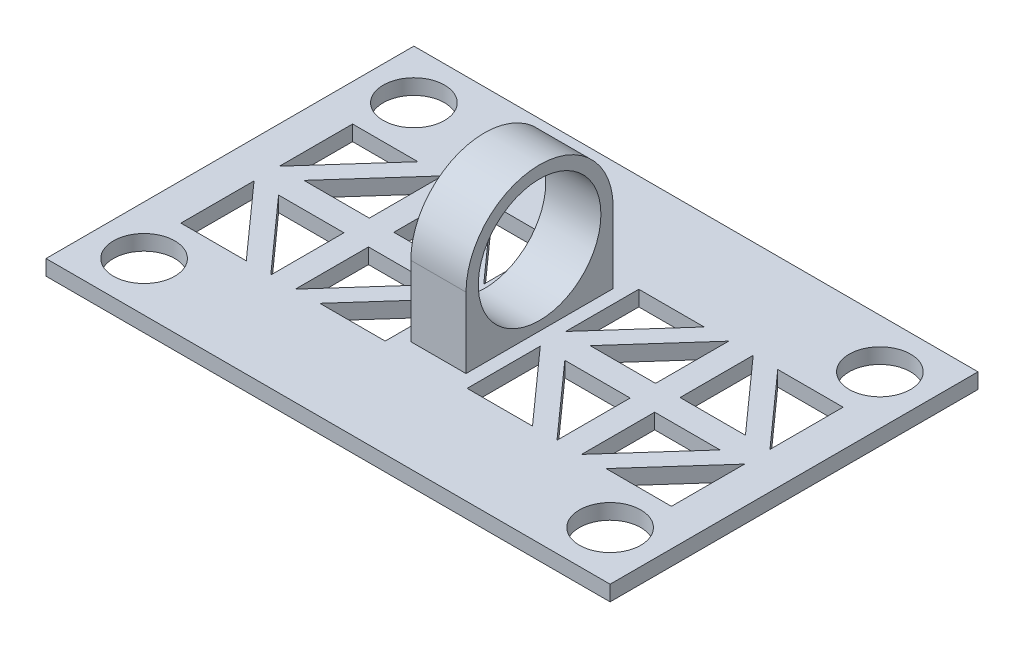
from build123d import *

# Parameters (mm, degrees)
SKETCH1_W            = 58.42
SKETCH1_H            = 38.1
BOSS_EXTRUDE1_DEPTH  = 1.5875
BOSS_EXTRUDE2_DEPTH  = 2.8575
SKETCH4_R            = 6.35
CUT_EXTRUDE1_DEPTH   = 53.464413236
CUT_EXTRUDE2_DEPTH   = 72.324521774
MIRROR4_COPY_1_DEPTH = 72.324521774
SKETCH6_R            = 3.175
CUT_EXTRUDE3_DEPTH   = 72.324521774


with BuildPart() as part:
    # Sketch1 → Boss-Extrude1 (new body)
    with BuildSketch(Plane(origin=(0, 0, 0), x_dir=(1, 0, 0), z_dir=(0, 1, 0))):
        with Locations((-29.21, 19.05)):
            Rectangle(SKETCH1_W, SKETCH1_H)
    extrude(amount=BOSS_EXTRUDE1_DEPTH)

    # Sketch2 → Boss-Extrude2 (add, symmetric)
    with BuildSketch(Plane(origin=(-29.21, 0, 0), x_dir=(0, 0, -1), z_dir=(1, 0, 0))):
        with BuildLine():
            Line((11.43, 8.89), (11.43, 0))
            Line((11.43, 0), (26.67, 0))
            Line((26.67, 0), (26.67, 8.89))
            ThreePointArc((26.67, 8.89), (19.05, 16.51), (11.43, 8.89))
        make_face()
    extrude(amount=BOSS_EXTRUDE2_DEPTH, both=True)

    # Sketch4 → Cut-Extrude1 (cut, through all)
    with BuildSketch(Plane(origin=(-26.3525, 0, 0), x_dir=(0, 0, -1), z_dir=(1, 0, 0))):
        with Locations((19.05, 8.89)):
            Circle(SKETCH4_R)
    extrude(amount=-CUT_EXTRUDE1_DEPTH, mode=Mode.SUBTRACT)

    # Sketch5 → Cut-Extrude2 (cut, through all)
    with BuildSketch(Plane(origin=(0, 1.5875, 0), x_dir=(1, 0, 0), z_dir=(0, 1, 0))):
        Polygon((-54.61, 27.94), (-54.61, 20.363487121), (-47.840801185, 27.94), align=None)
        Polygon((-45.300801185, 27.94), (-52.07, 20.363487121), (-45.300801185, 20.363487121), align=None)
        Polygon((-42.760801185, 20.363487121), (-42.760801185, 27.94), (-35.99160237, 20.363487121), align=None)
        Polygon((-40.220801185, 27.94), (-33.45160237, 20.363487121), (-33.45160237, 27.94), align=None)
    cut_extrude2 = extrude(amount=-CUT_EXTRUDE2_DEPTH, mode=Mode.SUBTRACT)

    # Mirror2: Cut-Extrude2 across plane
    add(cut_extrude2.mirror(Plane(origin=(0, 0, -19.05), x_dir=(1, 0, 0), z_dir=(0, 0, -1))), mode=Mode.SUBTRACT)

    # Mirror3: Cut-Extrude2 across plane
    add(cut_extrude2.mirror(Plane(origin=(-29.21, 0, 0), x_dir=(0, 0, 1), z_dir=(1, 0, 0))), mode=Mode.SUBTRACT)

    # Mirror4 copy 1 sketch → Mirror4 copy 1 (cut, through all)
    with BuildSketch(Plane(origin=(-58.42, 1.5875, -38.1), x_dir=(-1, 0, 0), z_dir=(0, 1, 0))):
        Polygon((-54.61, 27.94), (-54.61, 20.363487121), (-47.840801185, 27.94), align=None)
        Polygon((-45.300801185, 27.94), (-52.07, 20.363487121), (-45.300801185, 20.363487121), align=None)
        Polygon((-42.760801185, 20.363487121), (-42.760801185, 27.94), (-35.99160237, 20.363487121), align=None)
        Polygon((-40.220801185, 27.94), (-33.45160237, 20.363487121), (-33.45160237, 27.94), align=None)
    extrude(amount=-MIRROR4_COPY_1_DEPTH, mode=Mode.SUBTRACT)

    # Sketch6 → Cut-Extrude3 (cut, through all)
    with BuildSketch(Plane(origin=(0, 1.5875, 0), x_dir=(1, 0, 0), z_dir=(0, 1, 0))):
        with Locations(Location((-53.34, 33.02, 0), (0, 0, 270))):
            Circle(SKETCH6_R)
        with Locations(Location((-5.08, 33.02, 0), (0, 0, 270))):
            Circle(SKETCH6_R)
        with Locations(Location((-5.08, 5.08, 0), (0, 0, 270))):
            Circle(SKETCH6_R)
        with Locations(Location((-53.34, 5.08, 0), (0, 0, 270))):
            Circle(SKETCH6_R)
    extrude(amount=-CUT_EXTRUDE3_DEPTH, mode=Mode.SUBTRACT)


solid = part.part
